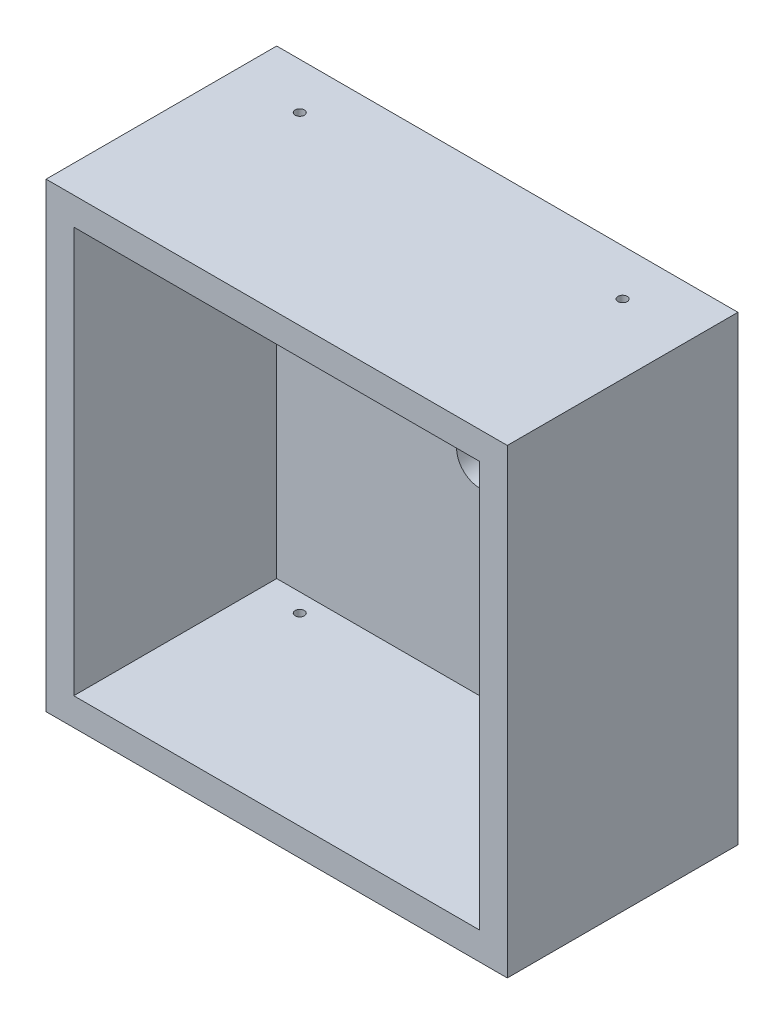
from build123d import *

# Parameters (mm, degrees)
ESQUISSE1_W             = 88
ESQUISSE1_H             = 88
BOSS_EXTRU_1_DEPTH      = 6
ESQUISSE2_R             = 5
ENL_V_MAT_EXTRU_1_DEPTH = 6
ESQUISSE3_W             = 88
ESQUISSE3_H             = 50
BOSS_EXTRU_2_DEPTH      = 6
ESQUISSE4_W             = 50
ESQUISSE4_H             = 94
BOSS_EXTRU_3_DEPTH      = 6
ESQUISSE5_W             = 50
ESQUISSE5_H             = 94
BOSS_EXTRU_4_DEPTH      = 6
ESQUISSE6_W             = 100
ESQUISSE6_H             = 50
BOSS_EXTRU_5_DEPTH      = 6
ESQUISSE7_R             = 1
ENL_V_MAT_EXTRU_2_DEPTH = 100


with BuildPart() as part:
    # Esquisse1 → Boss.-Extru.1 (new body)
    with BuildSketch(Plane.XY):
        Rectangle(ESQUISSE1_W, ESQUISSE1_H)
    extrude(amount=BOSS_EXTRU_1_DEPTH)

    # Esquisse2 → Enlèv. mat.-Extru.1 (cut)
    with BuildSketch(Plane.XY.offset(6)):
        Circle(ESQUISSE2_R)
    extrude(amount=-ENL_V_MAT_EXTRU_1_DEPTH, mode=Mode.SUBTRACT)

    # Esquisse3 → Boss.-Extru.2 (add)
    with BuildSketch(Plane(origin=(0, -44, 0), x_dir=(-1, 0, 0), z_dir=(0, -1, 0))):
        with Locations((0, -25)):
            Rectangle(ESQUISSE3_W, ESQUISSE3_H)
    extrude(amount=BOSS_EXTRU_2_DEPTH)

    # Esquisse4 → Boss.-Extru.3 (add)
    with BuildSketch(Plane.ZY.offset(44)):
        with Locations((25, -3)):
            Rectangle(ESQUISSE4_W, ESQUISSE4_H)
    extrude(amount=BOSS_EXTRU_3_DEPTH)

    # Esquisse5 → Boss.-Extru.4 (add)
    with BuildSketch(Plane(origin=(44, 0, 0), x_dir=(0, 0, -1), z_dir=(1, 0, 0))):
        with Locations((-25, -3)):
            Rectangle(ESQUISSE5_W, ESQUISSE5_H)
    extrude(amount=BOSS_EXTRU_4_DEPTH)

    # Esquisse6 → Boss.-Extru.5 (add)
    with BuildSketch(Plane(origin=(0, 44, 0), x_dir=(1, 0, 0), z_dir=(0, 1, 0))):
        with Locations((0, -25)):
            Rectangle(ESQUISSE6_W, ESQUISSE6_H)
    extrude(amount=BOSS_EXTRU_5_DEPTH)

    # Esquisse7 → Enlèv. mat.-Extru.2 (cut)
    with BuildSketch(Plane(origin=(0, 50, 0), x_dir=(1, 0, 0), z_dir=(0, 1, 0))):
        with Locations(Location((35, -10, 0), (0, 0, 270))):
            Circle(ESQUISSE7_R)
        with Locations(Location((-35, -10, 0), (0, 0, 270))):
            Circle(ESQUISSE7_R)
    extrude(amount=-ENL_V_MAT_EXTRU_2_DEPTH, mode=Mode.SUBTRACT)


solid = part.part
